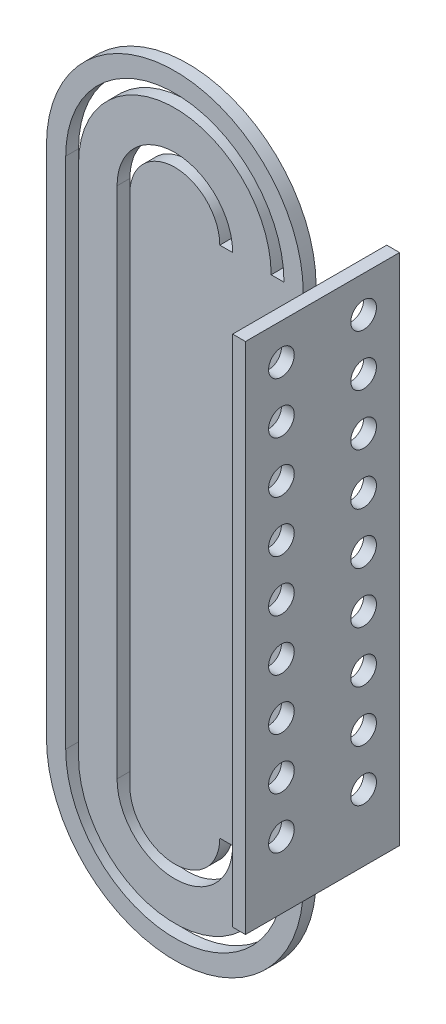
from build123d import *

# Parameters (mm, degrees)
SIDE_PROFILE_EXTRUDE_DEPTH             = 6.35
MOUNTING_BRACKET_PROFILE_SKETCH_W      = 152.4
MOUNTING_BRACKET_PROFILE_SKETCH_H      = 508
MOUNTING_BRACKET_PROFILE_EXTRUDE_DEPTH = 12.7
MOUNTING_BRACKET_HOLES_SKETCH_R        = 12.7
MOUNTING_BRACKET_HOLES_CUT_DEPTH       = 12.7
OUTER_TRACK_CUT_DEPTH                  = 12.7
INNER_TRACK_CUT_DEPTH                  = 12.7


with BuildPart() as part:
    # Side Profile Sketch → Side Profile Extrude (new, symmetric)
    with BuildSketch(Plane.XY):
        with BuildLine():
            Line((-127, 0), (-127, 508))
            ThreePointArc((-127, 508), (0, 635), (127, 508))
            Line((127, 508), (127, 0))
            ThreePointArc((127, 0), (0, -127), (-127, 0))
        make_face()
    extrude(amount=SIDE_PROFILE_EXTRUDE_DEPTH, both=True)

    # Mounting Bracket Profile Sketch → Mounting Bracket Profile Extrude (add)
    with BuildSketch(Plane(origin=(127, 0, 0), x_dir=(0, 0, -1), z_dir=(1, 0, 0))):
        with Locations((0, 254)):
            Rectangle(MOUNTING_BRACKET_PROFILE_SKETCH_W, MOUNTING_BRACKET_PROFILE_SKETCH_H)
    extrude(amount=MOUNTING_BRACKET_PROFILE_EXTRUDE_DEPTH)

    # Mounting Bracket Holes Sketch → Mounting Bracket Holes Cut (cut)
    with BuildSketch(Plane(origin=(139.7, 0, 0), x_dir=(0, 0, -1), z_dir=(1, 0, 0))):
        with Locations((-40.64, 472.44)):
            Circle(MOUNTING_BRACKET_HOLES_SKETCH_R)
        with Locations((-40.64, 421.64)):
            Circle(MOUNTING_BRACKET_HOLES_SKETCH_R)
        with Locations((-40.64, 370.84)):
            Circle(MOUNTING_BRACKET_HOLES_SKETCH_R)
        with Locations((-40.64, 320.04)):
            Circle(MOUNTING_BRACKET_HOLES_SKETCH_R)
        with Locations((-40.64, 269.24)):
            Circle(MOUNTING_BRACKET_HOLES_SKETCH_R)
        with Locations((-40.64, 218.44)):
            Circle(MOUNTING_BRACKET_HOLES_SKETCH_R)
        with Locations((-40.64, 167.64)):
            Circle(MOUNTING_BRACKET_HOLES_SKETCH_R)
        with Locations((-40.64, 116.84)):
            Circle(MOUNTING_BRACKET_HOLES_SKETCH_R)
        with Locations((-40.64, 66.04)):
            Circle(MOUNTING_BRACKET_HOLES_SKETCH_R)
        with Locations((40.64, 66.04)):
            Circle(MOUNTING_BRACKET_HOLES_SKETCH_R)
        with Locations((40.64, 116.84)):
            Circle(MOUNTING_BRACKET_HOLES_SKETCH_R)
        with Locations((40.64, 167.64)):
            Circle(MOUNTING_BRACKET_HOLES_SKETCH_R)
        with Locations((40.64, 218.44)):
            Circle(MOUNTING_BRACKET_HOLES_SKETCH_R)
        with Locations((40.64, 269.24)):
            Circle(MOUNTING_BRACKET_HOLES_SKETCH_R)
        with Locations((40.64, 320.04)):
            Circle(MOUNTING_BRACKET_HOLES_SKETCH_R)
        with Locations((40.64, 370.84)):
            Circle(MOUNTING_BRACKET_HOLES_SKETCH_R)
        with Locations((40.64, 421.64)):
            Circle(MOUNTING_BRACKET_HOLES_SKETCH_R)
        with Locations((40.64, 472.44)):
            Circle(MOUNTING_BRACKET_HOLES_SKETCH_R)
    extrude(amount=-MOUNTING_BRACKET_HOLES_CUT_DEPTH, mode=Mode.SUBTRACT)

    # Outer Track Sketch → Outer Track Cut (cut)
    with BuildSketch(Plane.XY.offset(6.35)):
        with BuildLine():
            Line((-107.95, 0), (-107.95, 508))
            ThreePointArc((-107.95, 508), (0, 615.95), (107.95, 508))
            Line((107.95, 508), (95.25, 508))
            ThreePointArc((95.25, 508), (0, 603.25), (-95.25, 508))
            Line((-95.25, 508), (-95.25, 0))
            ThreePointArc((-95.25, 0), (0, -95.25), (95.25, 0))
            Line((95.25, 0), (107.95, 0))
            ThreePointArc((107.95, 0), (0, -107.95), (-107.95, 0))
        make_face()
    extrude(amount=-OUTER_TRACK_CUT_DEPTH, mode=Mode.SUBTRACT)

    # Inner Track Sketch → Inner Track Cut (cut)
    with BuildSketch(Plane.XY.offset(6.35)):
        with BuildLine():
            Line((-57.15, 0), (-57.15, 508))
            ThreePointArc((-57.15, 508), (0, 565.15), (57.15, 508))
            Line((57.15, 508), (44.45, 508))
            ThreePointArc((44.45, 508), (0, 552.45), (-44.45, 508))
            Line((-44.45, 508), (-44.45, 0))
            ThreePointArc((-44.45, 0), (0, -44.45), (44.45, 0))
            Line((44.45, 0), (57.15, 0))
            ThreePointArc((57.15, 0), (0, -57.15), (-57.15, 0))
        make_face()
    extrude(amount=-INNER_TRACK_CUT_DEPTH, mode=Mode.SUBTRACT)


solid = part.part
